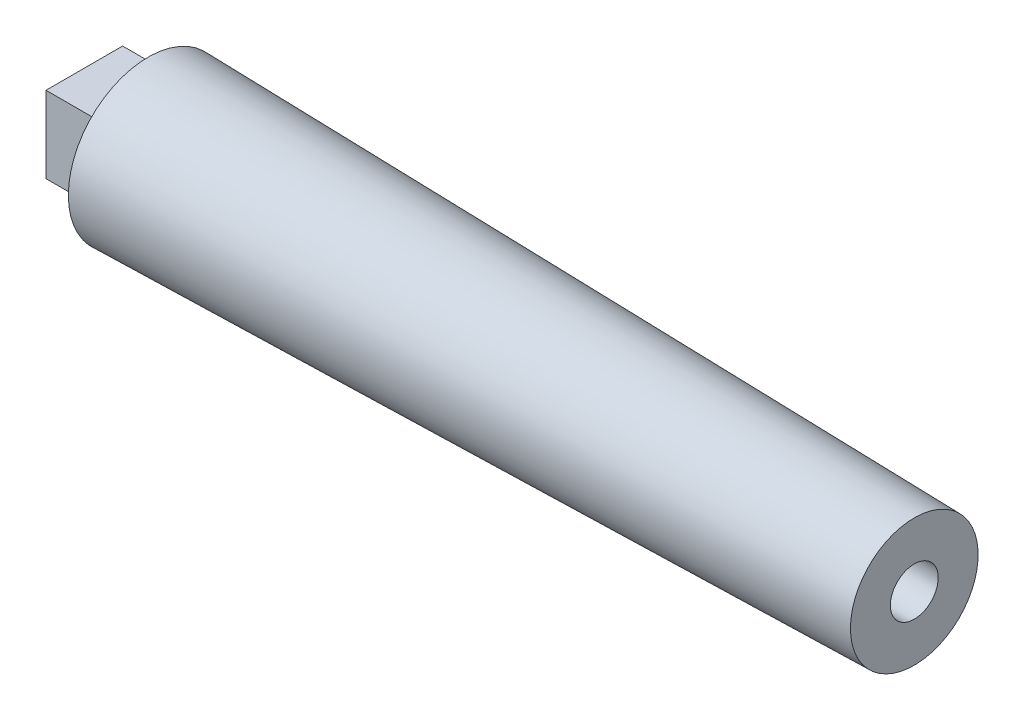
from build123d import *

# Parameters (mm, degrees)
SKETCH3_R           = 4.7625
CUT_EXTRUDE1_DEPTH  = 25.4
SKETCH4_W           = 15.24
SKETCH4_H           = 15.24
BOSS_EXTRUDE1_DEPTH = 12.7


with BuildPart() as part:
    # Sketch1 → Revolve2 (revolve)
    with BuildSketch(Plane.XY, mode=Mode.PRIVATE) as revolve2_sk:
        Polygon((0, 0), (152.4, 0), (152.4, 12.7), (0, 15.875), align=None)
    revolve(revolve2_sk.sketch.rotate(Axis((0, 0, 0), (1, 0, 0)), 90), axis=Axis((0, 0, 0), (1, 0, 0)))

    # Sketch3 → Cut-Extrude1 (cut)
    with BuildSketch(Plane(origin=(152.4, 0, 0), x_dir=(0, 0, -1), z_dir=(1, 0, 0))):
        Circle(SKETCH3_R)
    extrude(amount=-CUT_EXTRUDE1_DEPTH, mode=Mode.SUBTRACT)

    # Sketch4 → Boss-Extrude1 (add)
    with BuildSketch(Plane.ZY):
        Rectangle(SKETCH4_W, SKETCH4_H)
    extrude(amount=BOSS_EXTRUDE1_DEPTH)


solid = part.part
